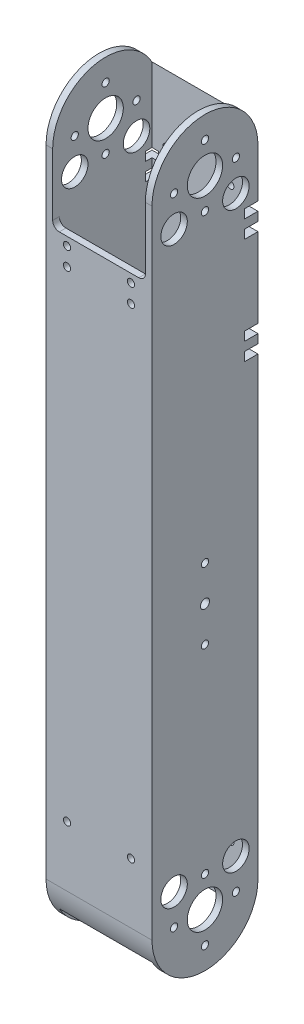
from build123d import *

# Parameters (mm, degrees)
BOSS_EXTRUDE1_START     = 33.3375
SKETCH1_R               = 12.7
BOSS_EXTRUDE1_DEPTH     = 4.7625
BOSS_EXTRUDE2_START     = -38.1
SKETCH1_6_R             = 12.7
BOSS_EXTRUDE2_DEPTH     = 4.7625
BOSS_EXTRUDE3_DEPTH     = 33.3375
BOSS_EXTRUDE4_START     = -38.1
BOSS_EXTRUDE4_DEPTH     = 38.1
SKETCH2_W               = 66.675
SKETCH2_H               = 67.807583187
CUT_EXTRUDE1_DEPTH      = 4.7625
SKETCH3_R               = 2.603499999
CUT_EXTRUDE2_DEPTH      = 4.7625
SKETCH4_R               = 2.6035
SKETCH4_R_2             = 2.603499999
CUT_EXTRUDE3_DEPTH      = 4.7625
SKETCH5_R               = 2.6035
SKETCH5_R_2             = 3.2639
CUT_EXTRUDE4_DEPTH      = 688.71544222
CUT_EXTRUDE5_DEPTH      = 685.541963263
CUT_EXTRUDE5_DEPTH_BACK = 685.541963263
SKETCH6_R               = 2.6035
SKETCH7_R               = 9.525
CUT_EXTRUDE6_DEPTH      = 688.71544222
FILLET1_R               = 4.7625
SKETCH8_W               = 9.525
SKETCH8_H               = 6.35
CUT_EXTRUDE7_DEPTH      = 9.525


with BuildPart() as part:
    # Sketch1 → Boss-Extrude1 (new body)
    with BuildSketch(Plane(origin=(0, 0, 0), x_dir=(0, 0, -1), z_dir=(1, 0, 0)).offset(BOSS_EXTRUDE1_START)):
        with BuildLine():
            Line((41.306573009, 186.931527045), (41.306573009, 644.131527045))
            ThreePointArc((41.306573009, 644.131527045), (3.206573009, 682.231527045), (-34.893426991, 644.131527045))
            Line((-34.893426991, 644.131527045), (-34.893426991, 186.931527045))
            ThreePointArc((-34.893426991, 186.931527045), (3.206573009, 148.831527045), (41.306573009, 186.931527045))
        make_face()
        with Locations((3.206573009, 186.931527045)):
            Circle(SKETCH1_R, mode=Mode.SUBTRACT)
        with Locations((3.206573009, 644.131527045)):
            Circle(SKETCH1_R, mode=Mode.SUBTRACT)
    extrude(amount=BOSS_EXTRUDE1_DEPTH)

    # Sketch1<7> → Boss-Extrude3 (add)
    with BuildSketch(Plane(origin=(0, 0, 0), x_dir=(0, 0, -1), z_dir=(1, 0, 0))):
        with BuildLine():
            ThreePointArc((-34.893426991, 186.931527045), (-33.683593364, 177.406527045), (-30.130926991, 168.486443859))
            Line((-30.130926991, 168.486443859), (-30.130926991, 662.576610232))
            ThreePointArc((-30.130926991, 662.576610232), (-33.683593364, 653.656527045), (-34.893426991, 644.131527045))
            Line((-34.893426991, 644.131527045), (-34.893426991, 186.931527045))
        make_face()
        with BuildLine():
            ThreePointArc((36.544073009, 168.486443859), (40.096739381, 177.406527045), (41.306573009, 186.931527045))
            Line((41.306573009, 186.931527045), (41.306573009, 644.131527045))
            ThreePointArc((41.306573009, 644.131527045), (40.096739381, 653.656527045), (36.544073009, 662.576610232))
            Line((36.544073009, 662.576610232), (36.544073009, 168.486443859))
        make_face()
    extrude(amount=BOSS_EXTRUDE3_DEPTH)



with BuildPart() as body_2:
    # Sketch1<6> → Boss-Extrude2 (new body)
    with BuildSketch(Plane(origin=(0, 0, 0), x_dir=(0, 0, -1), z_dir=(1, 0, 0)).offset(BOSS_EXTRUDE2_START)):
        with BuildLine():
            Line((41.306573009, 186.931527045), (41.306573009, 644.131527045))
            ThreePointArc((41.306573009, 644.131527045), (3.206573009, 682.231527045), (-34.893426991, 644.131527045))
            Line((-34.893426991, 644.131527045), (-34.893426991, 186.931527045))
            ThreePointArc((-34.893426991, 186.931527045), (3.206573009, 148.831527045), (41.306573009, 186.931527045))
        make_face()
        with Locations(Location((3.206573009, 186.931527045, 0), (0, 0, 180))):
            Circle(SKETCH1_6_R, mode=Mode.SUBTRACT)
        with Locations(Location((3.206573009, 644.131527045, 0), (0, 0, 180))):
            Circle(SKETCH1_6_R, mode=Mode.SUBTRACT)
    extrude(amount=BOSS_EXTRUDE2_DEPTH)


with BuildPart() as part_1:
    add(part.part)

    add(body_2.part)  # Boss-Extrude4 merges body 2
    # Sketch1<8> → Boss-Extrude4 (add)
    with BuildSketch(Plane(origin=(0, 0, 0), x_dir=(0, 0, -1), z_dir=(1, 0, 0)).offset(BOSS_EXTRUDE4_START)):
        with BuildLine():
            ThreePointArc((-34.893426991, 186.931527045), (-33.683593364, 177.406527045), (-30.130926991, 168.486443859))
            Line((-30.130926991, 168.486443859), (-30.130926991, 662.576610232))
            ThreePointArc((-30.130926991, 662.576610232), (-33.683593364, 653.656527045), (-34.893426991, 644.131527045))
            Line((-34.893426991, 644.131527045), (-34.893426991, 186.931527045))
        make_face()
        with BuildLine():
            ThreePointArc((36.544073009, 168.486443859), (40.096739381, 177.406527045), (41.306573009, 186.931527045))
            Line((41.306573009, 186.931527045), (41.306573009, 644.131527045))
            ThreePointArc((41.306573009, 644.131527045), (40.096739381, 653.656527045), (36.544073009, 662.576610232))
            Line((36.544073009, 662.576610232), (36.544073009, 168.486443859))
        make_face()
    extrude(amount=BOSS_EXTRUDE4_DEPTH)

    # Sketch2 → Cut-Extrude1 (cut)
    with BuildSketch(Plane.XY.offset(34.893426991)):
        with Locations((0, 628.672818639)):
            Rectangle(SKETCH2_W, SKETCH2_H)
    extrude(amount=-CUT_EXTRUDE1_DEPTH, mode=Mode.SUBTRACT)

    # Sketch3 → Cut-Extrude2 (cut)
    with BuildSketch(Plane.XY.offset(34.893426991)):
        with Locations((23, 575.769027045)):
            Circle(SKETCH3_R)
        with Locations((23, 588.769027045)):
            Circle(SKETCH3_R)
        with Locations((-23, 575.769027045)):
            Circle(SKETCH3_R)
        with Locations((-23, 588.769027045)):
            Circle(SKETCH3_R)
        with Locations((-23, 230.269027045)):
            Circle(SKETCH3_R)
        with Locations((23, 230.269027045)):
            Circle(SKETCH3_R)
    extrude(amount=-CUT_EXTRUDE2_DEPTH, mode=Mode.SUBTRACT)

    # Sketch4 → Cut-Extrude3 (cut)
    with BuildSketch(Plane(origin=(0, 0, -41.306573009), x_dir=(-1, 0, 0), z_dir=(0, 0, -1))):
        with Locations(Location((-23, 205.631527043, 0), (0, 0, 90))):
            Circle(SKETCH4_R)
        with Locations(Location((-23, 218.631527043, 0), (0, 0, 90))):
            Circle(SKETCH4_R)
        with Locations(Location((23, 218.631527043, 0), (0, 0, 90))):
            Circle(SKETCH4_R)
        with Locations(Location((23, 205.631527043, 0), (0, 0, 90))):
            Circle(SKETCH4_R)
        with Locations(Location((23, 614.131527045, 0), (0, 0, 90))):
            Circle(SKETCH4_R_2)
        with Locations(Location((-23, 614.131527045, 0), (0, 0, 90))):
            Circle(SKETCH4_R_2)
    extrude(amount=-CUT_EXTRUDE3_DEPTH, mode=Mode.SUBTRACT)

    # Sketch5 → Cut-Extrude4 (cut, through all)
    with BuildSketch(Plane.ZY.offset(38.1)):
        with Locations(Location((-3.206573009, 352.031527045, 0), (0, 0, 270))):
            Circle(SKETCH5_R)
        with Locations(Location((-3.206573009, 402.831527045, 0), (0, 0, 270))):
            Circle(SKETCH5_R)
        with Locations(Location((-3.206573009, 377.431527045, 0), (0, 0, 270))):
            Circle(SKETCH5_R_2)
    extrude(amount=-CUT_EXTRUDE4_DEPTH, mode=Mode.SUBTRACT)

    # Sketch6 → Cut-Extrude5 (cut, two sides: drawn at the far end of the back side and taken through both)
    with BuildSketch(Plane(origin=(0, 0, 0), x_dir=(0, 0, -1), z_dir=(1, 0, 0)).offset(-CUT_EXTRUDE5_DEPTH_BACK)):
        with Locations((25.431573009, 186.931527045)):
            Circle(SKETCH6_R)
        with Locations((3.206573009, 209.156527045)):
            Circle(SKETCH6_R)
        with Locations((-19.018426991, 186.931527045)):
            Circle(SKETCH6_R)
        with Locations((3.206573009, 164.706527045)):
            Circle(SKETCH6_R)
        with Locations((-19.018426991, 644.131527045)):
            Circle(SKETCH6_R)
        with Locations((3.206573009, 666.356527045)):
            Circle(SKETCH6_R)
        with Locations((25.431573009, 644.131527045)):
            Circle(SKETCH6_R)
        with Locations((3.206573009, 621.906527045)):
            Circle(SKETCH6_R)
    extrude(amount=CUT_EXTRUDE5_DEPTH + CUT_EXTRUDE5_DEPTH_BACK, mode=Mode.SUBTRACT)

    # Sketch7 → Cut-Extrude6 (cut, through all)
    with BuildSketch(Plane(origin=(38.1, 0, 0), x_dir=(0, 0, -1), z_dir=(1, 0, 0))):
        with Locations((25.431573009, 209.156527045)):
            Circle(SKETCH7_R)
        with Locations(Location((25.431573009, 621.906527045, 0), (0, 0, 270))):
            Circle(SKETCH7_R)
        with Locations(Location((-19.018426991, 209.156527045, 0), (0, 0, 270))):
            Circle(SKETCH7_R)
        with Locations((-19.018426991, 621.906527045)):
            Circle(SKETCH7_R)
    extrude(amount=-CUT_EXTRUDE6_DEPTH, mode=Mode.SUBTRACT)

    # Fillet1
    fillet1_edges = [part_1.edges().sort_by_distance(p)[0] for p in [
        (-33.3375, 594.769027045, 32.512176991),
        (33.3375, 594.769027045, 32.512176991),
    ]]
    fillet(fillet1_edges, radius=FILLET1_R)

    # Sketch8 → Cut-Extrude7 (cut)
    with BuildSketch(Plane.ZY.offset(38.1)):
        with Locations((-36.544073009, 606.031527045)):
            Rectangle(SKETCH8_W, SKETCH8_H)
        with Locations((-36.544073009, 593.331527045)):
            Rectangle(SKETCH8_W, SKETCH8_H)
        with Locations((-36.544073009, 529.831527045)):
            Rectangle(SKETCH8_W, SKETCH8_H)
        with Locations((-36.544073009, 517.131527045)):
            Rectangle(SKETCH8_W, SKETCH8_H)
    cut_extrude7 = extrude(amount=-CUT_EXTRUDE7_DEPTH, mode=Mode.SUBTRACT)

    # Mirror1: Cut-Extrude7 across plane
    add(cut_extrude7.mirror(Plane(origin=(0, 0, 0), x_dir=(0, 0, 1), z_dir=(1, 0, 0))), mode=Mode.SUBTRACT)


solid = part_1.part
